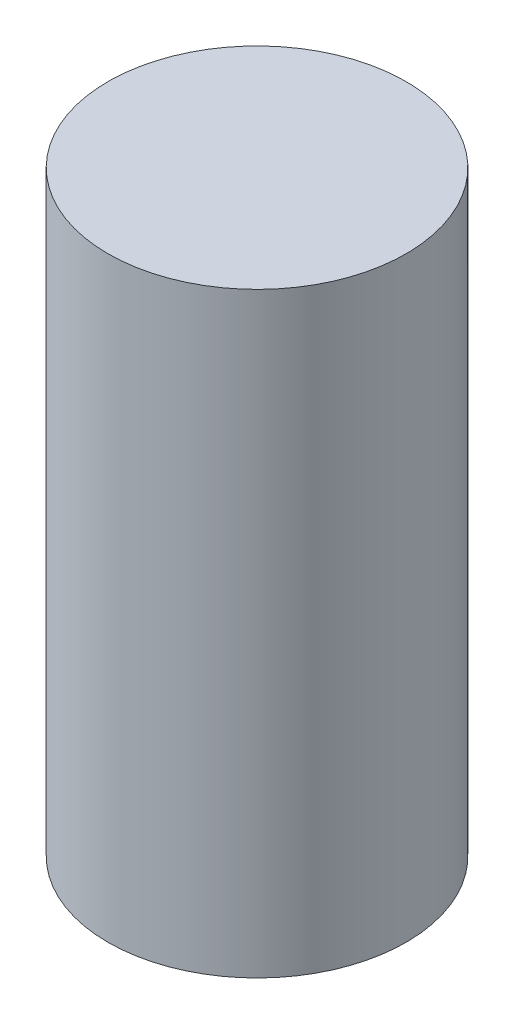
from build123d import *

# Parameters (mm, degrees)
SKETCH2_R           = 6.35
BOSS_EXTRUDE1_DEPTH = 25.4


with BuildPart() as part:
    # Sketch2 → Boss-Extrude1 (new body)
    with BuildSketch(Plane(origin=(0, 0, 0), x_dir=(1, 0, 0), z_dir=(0, 1, 0))):
        with Locations(Location((0, 0, 0), (0, 0, 270))):
            Circle(SKETCH2_R)
    extrude(amount=BOSS_EXTRUDE1_DEPTH)


solid = part.part
